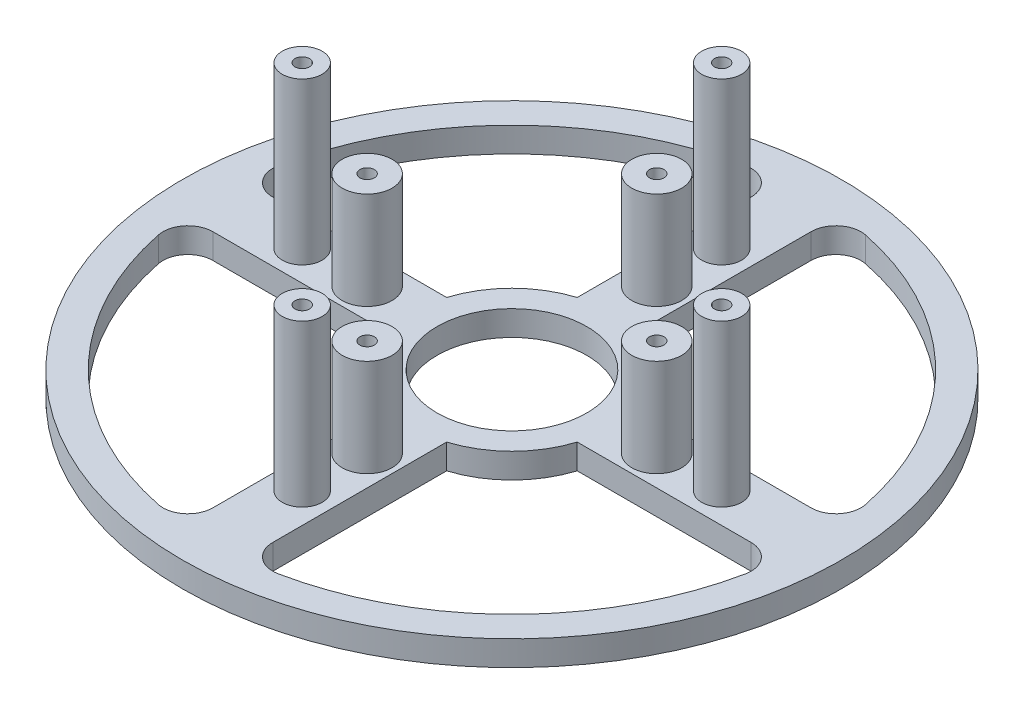
from build123d import *

# Parameters (mm, degrees)
SKETCH1_R           = 66
BOSS_EXTRUDE1_DEPTH = 5
FILLET1_R           = 5
SKETCH3_R           = 5
BOSS_EXTRUDE3_DEPTH = 19.5
SKETCH4_R           = 20
BOSS_EXTRUDE4_DEPTH = 5
CIRPATTERN1_COUNT   = 4
SKETCH5_R           = 15
CUT_EXTRUDE1_DEPTH  = 10
SKETCH6_R           = 4
BOSS_EXTRUDE5_DEPTH = 32.25
CIRPATTERN2_COUNT   = 4
CUT_EXTRUDE3_START  = -6
SKETCH7_R           = 1.45
CUT_EXTRUDE3_DEPTH  = 103.5
CIRPATTERN3_COUNT   = 4


with BuildPart() as part:
    # Sketch1 → Boss-Extrude1 (new body)
    with BuildSketch(Plane(origin=(0, 0, 0), x_dir=(1, 0, 0), z_dir=(0, 1, 0))):
        with Locations(Location((0, 0, 0), (0, 0, 270))):
            Circle(SKETCH1_R)
        with BuildLine():
            Line((-6, -59.699246226), (-6, -6))
            Line((-6, -6), (-59.699246226, -6))
            ThreePointArc((-59.699246226, -6), (-42.426406871, -42.426406871), (-6, -59.699246226))
        make_face(mode=Mode.SUBTRACT)
        with BuildLine():
            Line((6, -59.699246226), (6, -6))
            Line((6, -6), (59.699246226, -6))
            ThreePointArc((59.699246226, -6), (42.426406871, -42.426406871), (6, -59.699246226))
        make_face(mode=Mode.SUBTRACT)
        with BuildLine():
            Line((-59.699246226, 6), (-6, 6))
            Line((-6, 6), (-6, 59.699246226))
            ThreePointArc((-6, 59.699246226), (-42.426406871, 42.426406871), (-59.699246226, 6))
        make_face(mode=Mode.SUBTRACT)
        with BuildLine():
            Line((6, 6), (6, 59.699246226))
            ThreePointArc((6, 59.699246226), (42.426406871, 42.426406871), (59.699246226, 6))
            Line((59.699246226, 6), (6, 6))
        make_face(mode=Mode.SUBTRACT)
    extrude(amount=BOSS_EXTRUDE1_DEPTH)

    # Fillet1
    fillet1_edges = [part.edges().sort_by_distance(p)[0] for p in [
        (-6, 2.5, -59.699246226),
        (-59.699246226, 2.5, -6),
        (-6, 2.5, -6),
        (6, 2.5, 59.699246226),
        (59.699246226, 2.5, 6),
        (6, 2.5, 6),
        (59.699246226, 2.5, -6),
        (6, 2.5, -59.699246226),
        (6, 2.5, -6),
        (-59.699246226, 2.5, 6),
        (-6, 2.5, 59.699246226),
        (-6, 2.5, 6),
    ]]
    fillet(fillet1_edges, radius=FILLET1_R)

    # Sketch3 → Boss-Extrude3 (add)
    with BuildSketch(Plane(origin=(0, 5, 0), x_dir=(1, 0, 0), z_dir=(0, 1, 0))):
        with Locations(Location((-29, 0, 0), (0, 0, 270))):
            Circle(SKETCH3_R)
    boss_extrude3 = extrude(amount=BOSS_EXTRUDE3_DEPTH)

    # Sketch4 → Boss-Extrude4 (add)
    with BuildSketch(Plane(origin=(0, 5, 0), x_dir=(1, 0, 0), z_dir=(0, 1, 0))):
        Circle(SKETCH4_R)
    extrude(amount=-BOSS_EXTRUDE4_DEPTH)

    # CirPattern1: Boss-Extrude3 ×4 about axis
    cirpattern1_axis = Axis((0, 0, 0), (0, 1, 0))
    for i in range(1, CIRPATTERN1_COUNT):
        add(boss_extrude3.rotate(cirpattern1_axis, i * 360 / CIRPATTERN1_COUNT))

    # Sketch5 → Cut-Extrude1 (cut)
    with BuildSketch(Plane(origin=(0, 5, 0), x_dir=(1, 0, 0), z_dir=(0, 1, 0))):
        with Locations(Location((0, 0, 0), (0, 0, 270))):
            Circle(SKETCH5_R)
    extrude(amount=-CUT_EXTRUDE1_DEPTH, mode=Mode.SUBTRACT)

    # Sketch6 → Boss-Extrude5 (add)
    with BuildSketch(Plane(origin=(0, 5, 0), x_dir=(1, 0, 0), z_dir=(0, 1, 0))):
        with Locations(Location((-42, 0, 0), (0, 0, 270))):
            Circle(SKETCH6_R)
    boss_extrude5 = extrude(amount=BOSS_EXTRUDE5_DEPTH)

    # CirPattern2: Boss-Extrude5 ×4 about axis
    cirpattern2_axis = Axis((0, 0, 0), (0, 1, 0))
    for i in range(1, CIRPATTERN2_COUNT):
        add(boss_extrude5.rotate(cirpattern2_axis, i * 360 / CIRPATTERN2_COUNT))

    # Sketch7 → Cut-Extrude3 (cut)
    with BuildSketch(Plane(origin=(0, 24.5, 0), x_dir=(1, 0, 0), z_dir=(0, 1, 0)).offset(CUT_EXTRUDE3_START)):
        with Locations(Location((-29, 0, 0), (0, 0, 270))):
            Circle(SKETCH7_R)
        with Locations(Location((-42, 0, 0), (0, 0, 270))):
            Circle(SKETCH7_R)
    cut_extrude3 = extrude(amount=CUT_EXTRUDE3_DEPTH, mode=Mode.SUBTRACT)

    # CirPattern3: Cut-Extrude3 ×4 about axis
    cirpattern3_axis = Axis((0, 0, 0), (0, 1, 0))
    for i in range(1, CIRPATTERN3_COUNT):
        add(cut_extrude3.rotate(cirpattern3_axis, i * 360 / CIRPATTERN3_COUNT), mode=Mode.SUBTRACT)


solid = part.part
